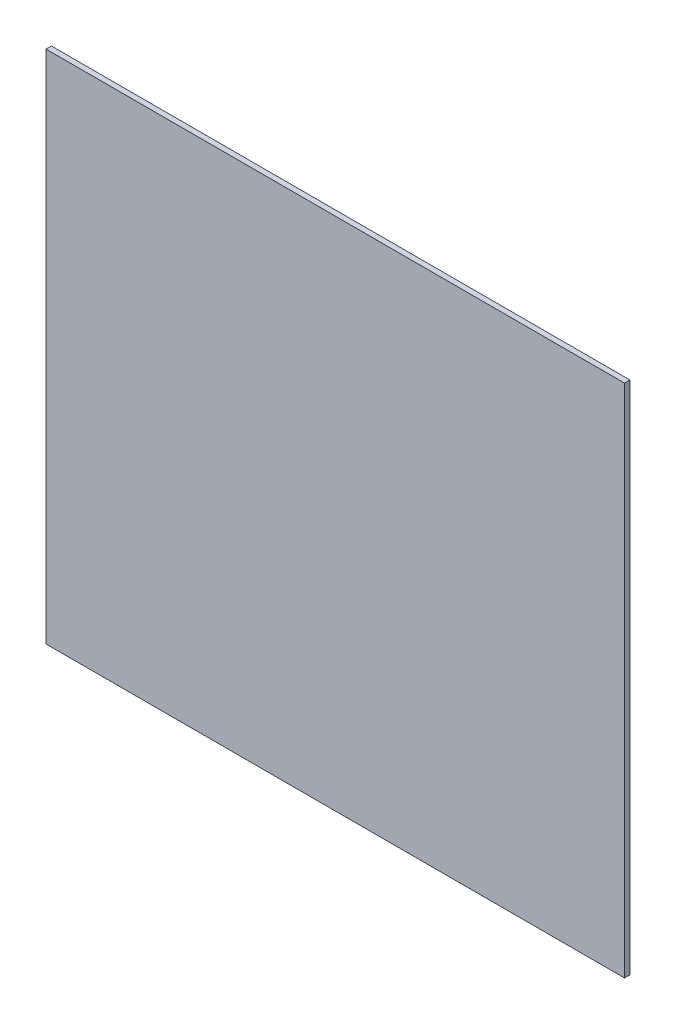
from build123d import *

# Parameters (mm, degrees)
SKETCH1_W           = 320
SKETCH1_H           = 285
BOSS_EXTRUDE1_DEPTH = 3


with BuildPart() as part:
    # Sketch1 → Boss-Extrude1 (new body)
    with BuildSketch(Plane.XY):
        Rectangle(SKETCH1_W, SKETCH1_H)
    extrude(amount=BOSS_EXTRUDE1_DEPTH)


solid = part.part
